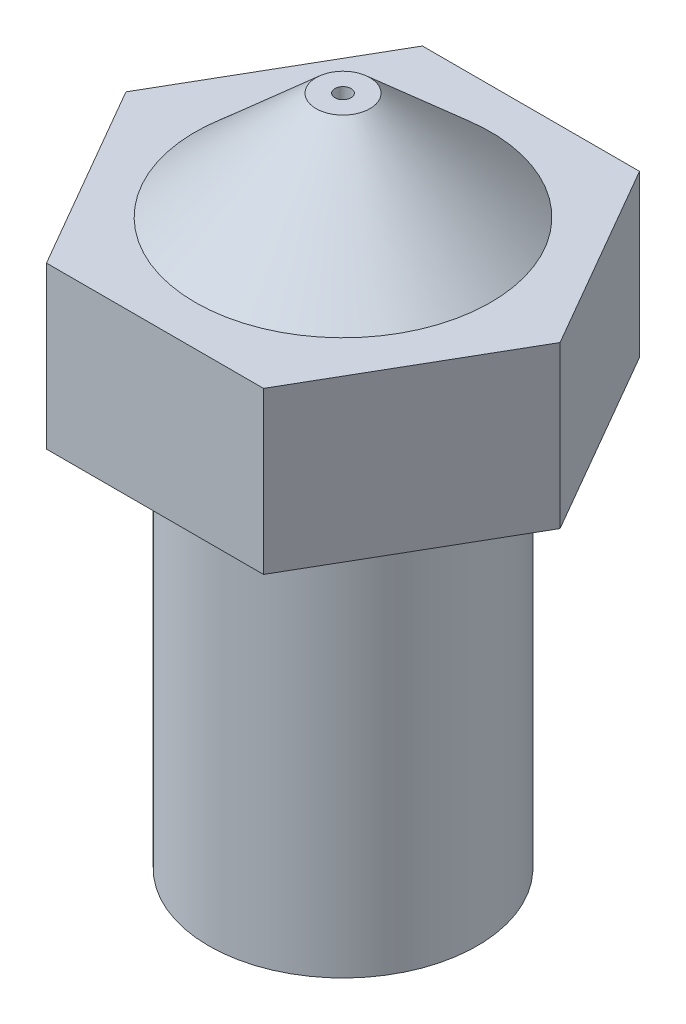
from build123d import *

# Parameters (mm, degrees)
BOSS_EXTRUDE1_DEPTH = 3
SKETCH2_R           = 2.75
BOSS_EXTRUDE2_DEPTH = 2
BOSS_EXTRUDE2_TAPER = 48.36
SKETCH4_R           = 0.15
CUT_EXTRUDE1_DEPTH  = 1.5
SKETCH6_R           = 2.5
BOSS_EXTRUDE3_DEPTH = 7.5
SKETCH7_R           = 1
CUT_EXTRUDE3_DEPTH  = 11


with BuildPart() as part:
    # Sketch1 → Boss-Extrude1 (new body)
    with BuildSketch(Plane(origin=(0, 0, 0), x_dir=(1, 0, 0), z_dir=(0, 1, 0))):
        Polygon((4.041451884, 0), (2.020725942, 3.5), (-2.020725942, 3.5), (-4.041451884, 0), (-2.020725942, -3.5), (2.020725942, -3.5), align=None)
    extrude(amount=BOSS_EXTRUDE1_DEPTH)

    # Sketch2 → Boss-Extrude2 (add)
    with BuildSketch(Plane(origin=(0, 3, 0), x_dir=(1, 0, 0), z_dir=(0, 1, 0))):
        Circle(SKETCH2_R)
    extrude(amount=BOSS_EXTRUDE2_DEPTH, taper=BOSS_EXTRUDE2_TAPER)

    # Sketch4 → Cut-Extrude1 (cut)
    with BuildSketch(Plane(origin=(0, 5, 0), x_dir=(1, 0, 0), z_dir=(0, 1, 0))):
        with Locations(Location((0, 0, 0), (0, 0, 270))):
            Circle(SKETCH4_R)
    extrude(amount=-CUT_EXTRUDE1_DEPTH, mode=Mode.SUBTRACT)

    # Sketch6 → Boss-Extrude3 (add)
    with BuildSketch(Plane.XZ):
        with Locations(Location((0, 0, 0), (0, 0, 270))):
            Circle(SKETCH6_R)
    extrude(amount=BOSS_EXTRUDE3_DEPTH)

    # Sketch7 → Cut-Extrude3 (cut)
    with BuildSketch(Plane.XZ.offset(7.5)):
        with Locations(Location((0, 0, 0), (0, 0, 270))):
            Circle(SKETCH7_R)
    extrude(amount=-CUT_EXTRUDE3_DEPTH, mode=Mode.SUBTRACT)


solid = part.part
